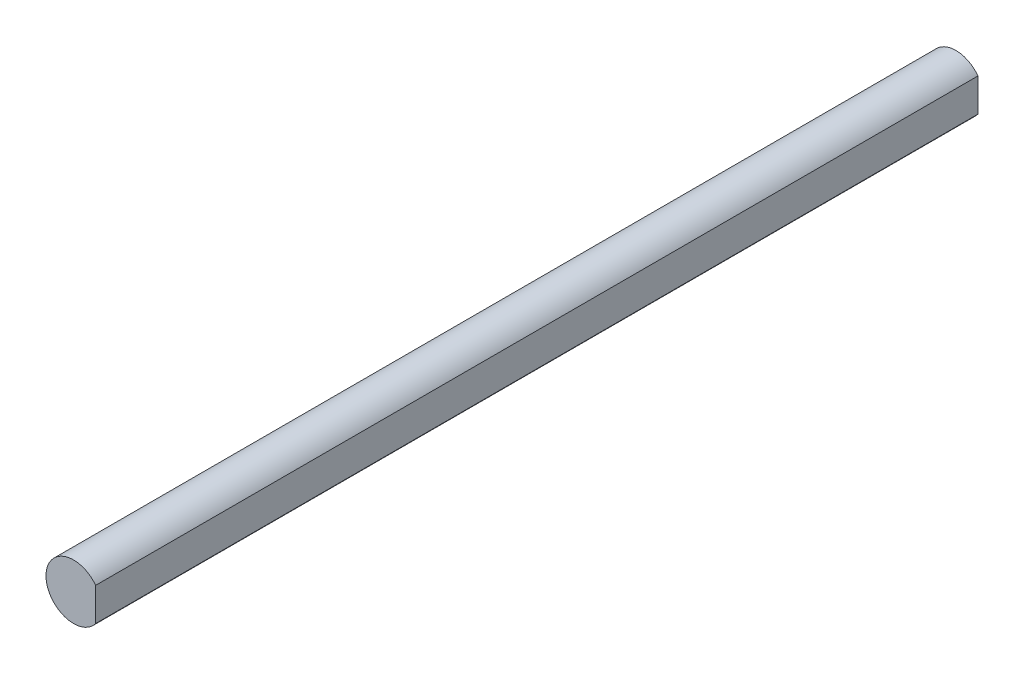
from build123d import *

# Parameters (mm, degrees)
ESQUISSE1_R             = 3.175
BOSS_EXTRU_1_DEPTH      = 101.6
ENL_V_MAT_EXTRU_1_DEPTH = 102.699170351


with BuildPart() as part:
    # Esquisse1 → Boss.-Extru.1 (new body)
    with BuildSketch(Plane.XY):
        Circle(ESQUISSE1_R)
    extrude(amount=BOSS_EXTRU_1_DEPTH)

    # Esquisse2 → Enlèv. mat.-Extru.1 (cut, through all)
    with BuildSketch(Plane.XY.offset(101.6)):
        with BuildLine():
            Line((2.54, 1.905), (2.54, -1.905))
            ThreePointArc((2.54, -1.905), (3.175, 0), (2.54, 1.905))
        make_face()
    extrude(amount=-ENL_V_MAT_EXTRU_1_DEPTH, mode=Mode.SUBTRACT)


solid = part.part
